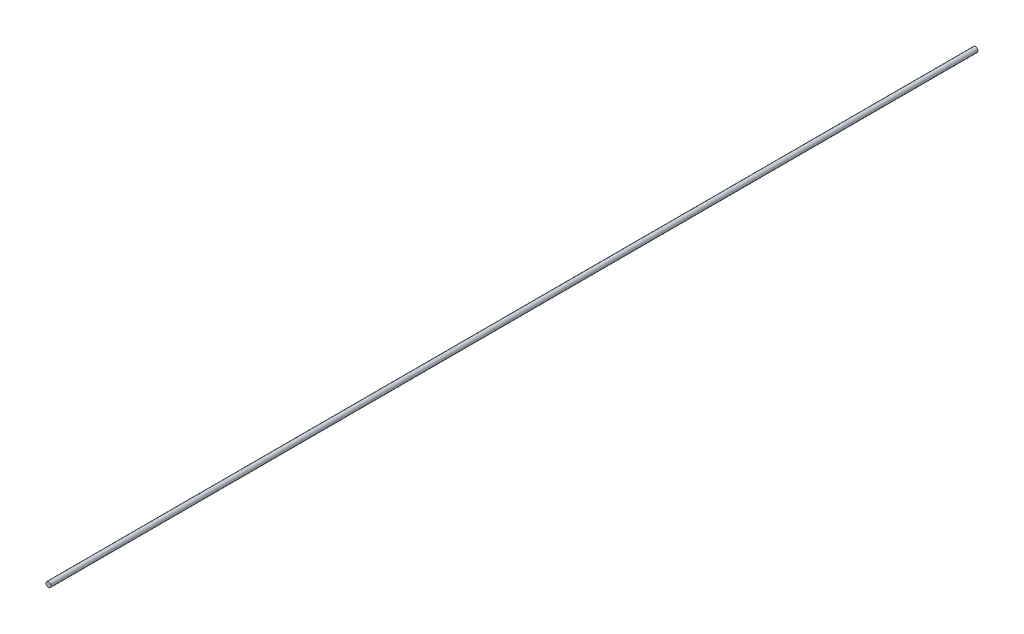
from build123d import *

# Parameters (mm, degrees)
SKETCH1_R           = 12.7
BOSS_EXTRUDE1_DEPTH = 4684.890020917


with BuildPart() as part:
    # Sketch1 → Boss-Extrude1 (new body)
    with BuildSketch(Plane.XY):
        Circle(SKETCH1_R)
    extrude(amount=BOSS_EXTRUDE1_DEPTH)


solid = part.part
